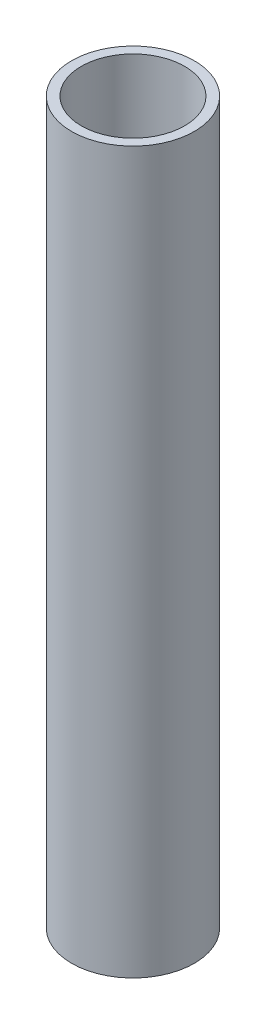
from build123d import *

# Parameters (mm, degrees)
SKETCH1_R           = 30.1625
SKETCH1_R_2         = 25.4
BOSS_EXTRUDE1_DEPTH = 177.165


with BuildPart() as part:
    # Sketch1 → Boss-Extrude1 (new, symmetric)
    with BuildSketch(Plane(origin=(0, 0, 0), x_dir=(1, 0, 0), z_dir=(0, 1, 0))):
        with Locations(Location((0, 0, 0), (0, 0, 270))):
            Circle(SKETCH1_R)
        with Locations(Location((0, 0, 0), (0, 0, 270))):
            Circle(SKETCH1_R_2, mode=Mode.SUBTRACT)
    extrude(amount=BOSS_EXTRUDE1_DEPTH, both=True)


solid = part.part
